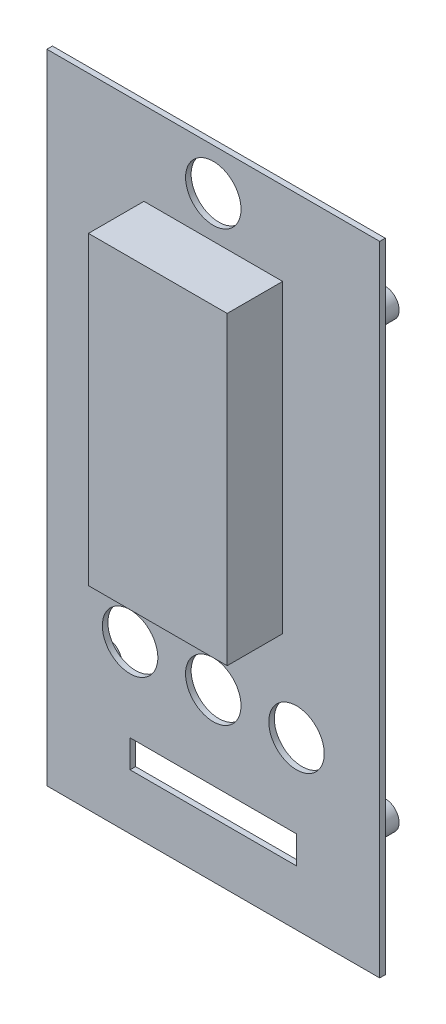
from build123d import *

# Parameters (mm, degrees)
SKETCH1_R                       = 2.5
POSTS_DEPTH                     = 5
POSTS_2_DEPTH                   = 5
POSTS_3_DEPTH                   = 5
POSTS_4_DEPTH                   = 5
SKETCH2_W                       = 60
SKETCH2_H                       = 115
ELECTRONICS_CIRCUIT_BOARD_DEPTH = 1
SKETCH3_R                       = 5
SKETCH3_W                       = 30
SKETCH3_H                       = 5
MOTOR_LEADS_DEPTH               = 129.646803303
SKETCH4_W                       = 25
SKETCH4_H                       = 55
ESC_DEPTH                       = 10


with BuildPart() as part:
    # Sketch1 → Posts (new body)
    with BuildSketch(Plane.XY.offset(-65)):
        with Locations((-25, 110)):
            Circle(SKETCH1_R)
    extrude(amount=POSTS_DEPTH)



with BuildPart() as body_2:
    # Sketch1 → Posts 2 (new body)
    with BuildSketch(Plane.XY.offset(-65)):
        with Locations((25, 110)):
            Circle(SKETCH1_R)
    extrude(amount=POSTS_2_DEPTH)


with BuildPart() as body_3:
    # Sketch1 → Posts 3 (new body)
    with BuildSketch(Plane.XY.offset(-65)):
        with Locations((25, 30)):
            Circle(SKETCH1_R)
    extrude(amount=POSTS_3_DEPTH)


with BuildPart() as body_4:
    # Sketch1 → Posts 4 (new body)
    with BuildSketch(Plane.XY.offset(-65)):
        with Locations((-25, 30)):
            Circle(SKETCH1_R)
    extrude(amount=POSTS_4_DEPTH)


with BuildPart() as part_1:
    add(part.part)

    add(body_2.part)  # Electronics Circuit Board merges body 2

    add(body_3.part)  # Electronics Circuit Board merges body 3

    add(body_4.part)  # Electronics Circuit Board merges body 4
    # Sketch2 → Electronics Circuit Board (add)
    with BuildSketch(Plane.XY.offset(-60)):
        with Locations((0, 67.5)):
            Rectangle(SKETCH2_W, SKETCH2_H)
    extrude(amount=ELECTRONICS_CIRCUIT_BOARD_DEPTH)

    # Sketch3 → Motor Leads (cut, through all)
    with BuildSketch(Plane(origin=(0, 0, -60), x_dir=(-1, 0, 0), z_dir=(0, 0, -1))):
        with Locations((0, 40)):
            Circle(SKETCH3_R)
        with Locations((-15, 40)):
            Circle(SKETCH3_R)
        with Locations((15, 40)):
            Circle(SKETCH3_R)
        with Locations((0, 117.5)):
            Circle(SKETCH3_R)
        with Locations((0, 22.5)):
            Rectangle(SKETCH3_W, SKETCH3_H)
    extrude(amount=-MOTOR_LEADS_DEPTH, mode=Mode.SUBTRACT)

    # Sketch4 → ESC (add)
    with BuildSketch(Plane.XY.offset(-59)):
        with Locations((0, 82.5)):
            Rectangle(SKETCH4_W, SKETCH4_H)
    extrude(amount=ESC_DEPTH)


solid = part_1.part
